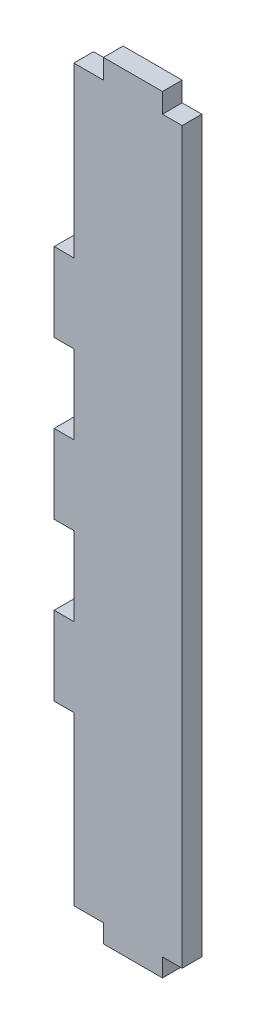
from build123d import *

# Parameters (mm, degrees)
BOSS_EXTRUDE1_DEPTH = 5


with BuildPart() as part:
    # Sketch1 → Boss-Extrude1 (new body)
    with BuildSketch(Plane.XY):
        Polygon((52.5, 185.35845109), (47.5, 185.35845109), (47.5, 190.35845109), (32.5, 190.35845109), (32.5, 185.35845109), (25, 185.35845109), (25, 142.5), (20, 142.5), (20, 122.5), (25, 122.5), (25, 102.5), (20, 102.5), (20, 82.5), (25, 82.5), (25, 62.5), (20, 62.5), (20, 42.5), (25, 42.5), (25, 0), (32.5, 0), (32.5, -4.64154891), (40, -4.64154891), (47.5, -4.64154891), (47.5, 0), (52.5, 0), align=None)
    extrude(amount=-BOSS_EXTRUDE1_DEPTH)


solid = part.part
